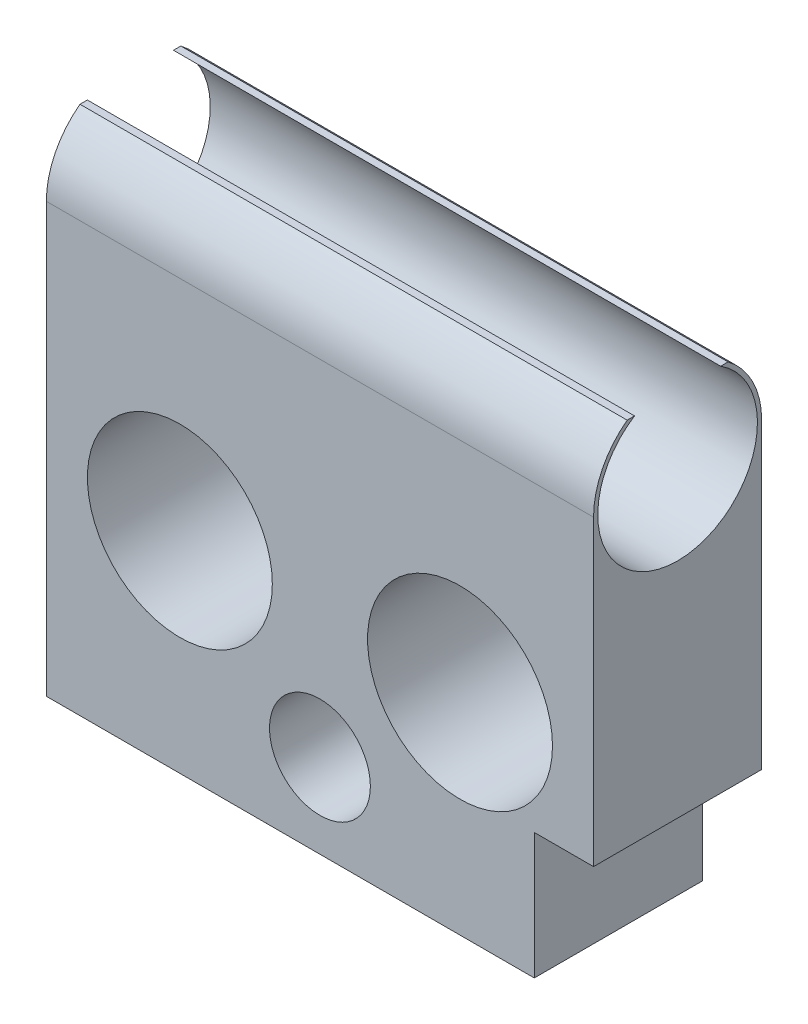
from build123d import *

# Parameters (mm, degrees)
PARALLELEPIPEDOBLOCCO_DEPTH      = 20
SCHIZZO2_R                       = 11
SCHIZZO2_R_2                     = 6
FORITUBIMOTORI_DEPTH             = 54.183667606
SCHIZZO4_R                       = 9.5
FOROLONGHERONE_DEPTH             = 78.504903071
ELIMINAZIONEPARTESUPERIORE_DEPTH = 78.504903071
SCHIZZO6_W                       = 7.05
SCHIZZO6_H                       = 15
SPAZIOMOVIMENTOLEVETTA_DEPTH     = 53.49288047
SCHIZZO7_W                       = 20
SCHIZZO7_H                       = 2
TAGLIOPORZIONESUPERIORE_DEPTH    = 65.1


with BuildPart() as part:
    # Schizzo1 → ParallelepipedoBlocco (new body)
    with BuildSketch(Plane.XY):
        Polygon((-30.55, -25), (30.55, -25), (32.55, -25), (32.55, 17), (32.55, 37), (-32.55, 37), (-32.55, 17), (-32.55, -25), align=None)
    extrude(amount=PARALLELEPIPEDOBLOCCO_DEPTH)

    # Schizzo2 → ForiTubiMotori (cut, through all)
    with BuildSketch(Plane.XY.offset(20)):
        with Locations((-16.665, 0)):
            Circle(SCHIZZO2_R)
        with Locations((16.665, 0)):
            Circle(SCHIZZO2_R)
        with Locations((0, -15)):
            Circle(SCHIZZO2_R_2)
    extrude(amount=-FORITUBIMOTORI_DEPTH, mode=Mode.SUBTRACT)

    # Schizzo4 → ForoLongherone (cut, through all)
    with BuildSketch(Plane.ZY.offset(32.55)):
        with Locations((10, 26)):
            Circle(SCHIZZO4_R)
    extrude(amount=-FOROLONGHERONE_DEPTH, mode=Mode.SUBTRACT)

    # Schizzo5 → EliminazioneParteSuperiore (cut, through all)
    with BuildSketch(Plane.ZY.offset(32.55)):
        with BuildLine():
            Line((0, 26), (0, 37))
            Line((0, 37), (20, 37))
            Line((20, 37), (20, 26))
            ThreePointArc((20, 26), (10, 36), (0, 26))
        make_face()
    extrude(amount=-ELIMINAZIONEPARTESUPERIORE_DEPTH, mode=Mode.SUBTRACT)

    # Schizzo6 → SpazioMovimentoLevetta (cut, through all)
    with BuildSketch(Plane.XY.offset(20)):
        with Locations((29.025, -17.5)):
            Rectangle(SCHIZZO6_W, SCHIZZO6_H)
    extrude(amount=-SPAZIOMOVIMENTOLEVETTA_DEPTH, mode=Mode.SUBTRACT)

    # Schizzo7 → TaglioPorzioneSuperiore (cut)
    with BuildSketch(Plane.ZY.offset(32.55)):
        with Locations((10, 35)):
            Rectangle(SCHIZZO7_W, SCHIZZO7_H)
    extrude(amount=-TAGLIOPORZIONESUPERIORE_DEPTH, mode=Mode.SUBTRACT)


solid = part.part
